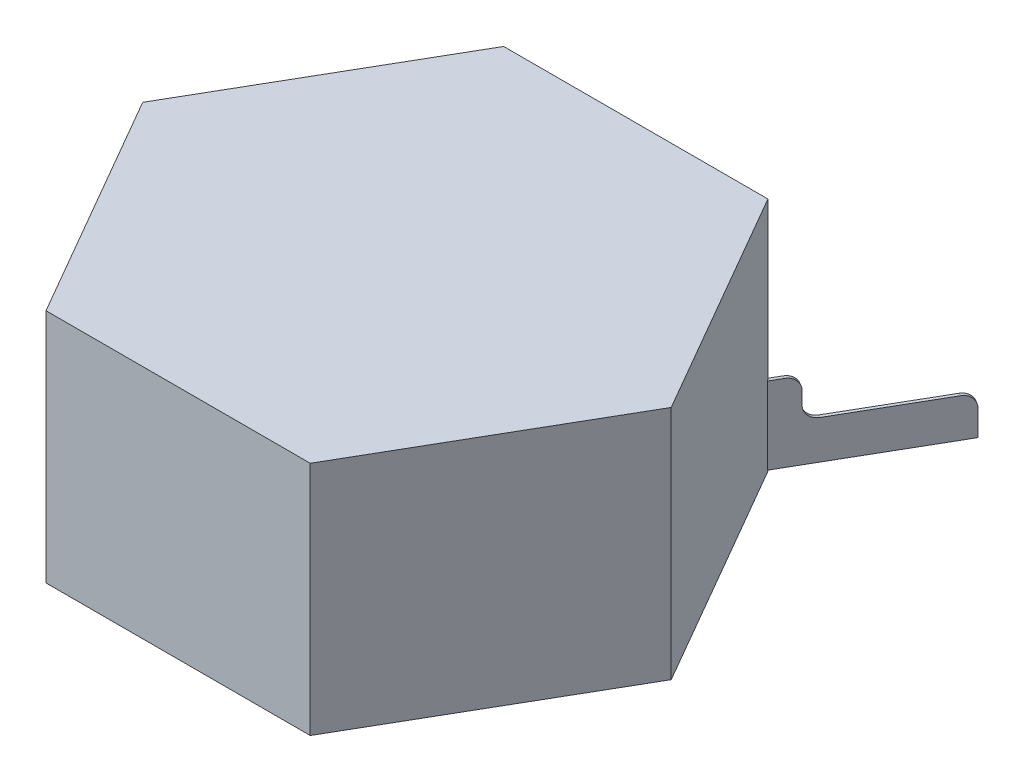
from build123d import *

# Parameters (mm, degrees)
BOSS_EXTRUDE1_DEPTH = 930.275
BOSS_EXTRUDE2_DEPTH = 12.7
BOSS_EXTRUDE3_DEPTH = 12.7


with BuildPart() as part:
    # Sketch1 → Boss-Extrude1 (new body)
    with BuildSketch(Plane(origin=(0, 6.35, 0), x_dir=(1, 0, 0), z_dir=(0, 1, 0))):
        Polygon((1767.90556734, 3586.561176343), (2810.457786806, 3586.561176343), (3331.733896538, 4489.437883172), (2810.457786805, 5392.314590001), (1767.90556734, 5392.314590001), (1246.629457607, 4489.437883172), align=None)
    extrude(amount=BOSS_EXTRUDE1_DEPTH)

    # Sketch2 → Boss-Extrude2 (add)
    with BuildSketch(Plane(origin=(-232.596631279, 0, -134.289727682), x_dir=(-0.500000000000017, 0, 0.8660254037844288), z_dir=(-0.8660254037844288, 0, -0.500000000000017))):
        with BuildLine():
            Line((-6222.929094075, 167.37838), (-6629.329094075, 167.37838))
            ThreePointArc((-6629.329094075, 167.37838), (-6665.250118559, 152.499404484), (-6680.129094075, 116.57838))
            Line((-6680.129094075, 116.57838), (-6680.129094075, 14.97838))
            Line((-6680.129094075, 14.97838), (-6070.529094075, 14.97838))
            Line((-6070.529094075, 14.97838), (-6070.529094075, 319.77838))
            Line((-6070.529094075, 319.77838), (-6121.329094075, 319.77838))
            ThreePointArc((-6121.329094075, 319.77838), (-6157.250118559, 304.899404484), (-6172.129094075, 268.97838))
            Line((-6172.129094075, 268.97838), (-6172.129094075, 218.17838))
            ThreePointArc((-6172.129094075, 218.17838), (-6187.008069591, 182.257355516), (-6222.929094075, 167.37838))
        make_face()
    extrude(amount=-BOSS_EXTRUDE2_DEPTH)

    # Sketch3 → Boss-Extrude3 (add)
    with BuildSketch(Plane(origin=(3655.37062426, 0, -2110.429213904), x_dir=(0.500000000000017, 0, 0.8660254037844288), z_dir=(-0.8660254037844288, 0, 0.500000000000017))):
        with BuildLine():
            Line((-3933.747417002, 167.37838), (-4340.147417002, 167.37838))
            ThreePointArc((-4340.147417002, 167.37838), (-4376.068441487, 152.499404484), (-4390.947417002, 116.57838))
            Line((-4390.947417002, 116.57838), (-4390.947417002, 14.97838))
            Line((-4390.947417002, 14.97838), (-3781.347417002, 14.97838))
            Line((-3781.347417002, 14.97838), (-3781.347417002, 319.77838))
            Line((-3781.347417002, 319.77838), (-3832.147417002, 319.77838))
            ThreePointArc((-3832.147417002, 319.77838), (-3868.068441487, 304.899404484), (-3882.947417002, 268.97838))
            Line((-3882.947417002, 268.97838), (-3882.947417002, 218.17838))
            ThreePointArc((-3882.947417002, 218.17838), (-3897.826392518, 182.257355516), (-3933.747417002, 167.37838))
        make_face()
    extrude(amount=-BOSS_EXTRUDE3_DEPTH)


solid = part.part
